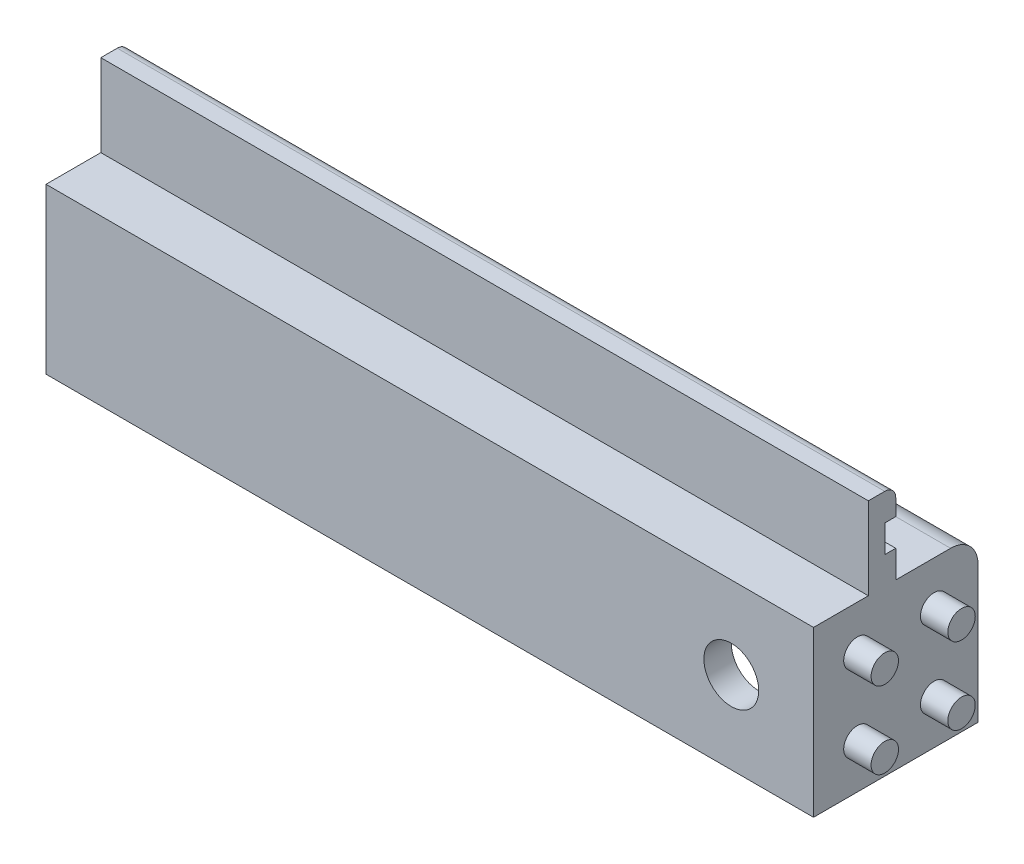
from build123d import *

# Parameters (mm, degrees)
SKETCH1_W                                       = 140
SKETCH1_H                                       = 30
BOSS_EXTRUDE1_DEPTH                             = 30
SHELL1_T                                        = -5
SKETCH3_W                                       = 5
SKETCH3_H                                       = 20
BOSS_EXTRUDE2_DEPTH                             = 25
SKETCH4_R                                       = 2.5
BOSS_EXTRUDE3_DEPTH                             = 5
SKETCH5_R                                       = 1.5
CUT_EXTRUDE1_DEPTH                              = 20
CUT_EXTRUDE2_DEPTH                              = 152.079449297
CUT_EXTRUDE2_DEPTH_BACK                         = 152.079449297
SKETCH9_R                                       = 5
SKETCH10_W                                      = 140
SKETCH10_H                                      = 5
BOSS_EXTRUDE5_DEPTH                             = 15
CUT_EXTRUDE3_START                              = -3
SKETCH14_W                                      = 135
SKETCH14_H                                      = 5
CUT_EXTRUDE3_DEPTH                              = 2
FILLET1_R                                       = 2
CSK_FOR_M5_FLAT_HEAD_MACHINE_SCREW1_D           = 5.5
CSK_FOR_M5_FLAT_HEAD_MACHINE_SCREW1_DEPTH       = 20
CSK_FOR_M5_FLAT_HEAD_MACHINE_SCREW1_CSINK_D     = 10.4
CSK_FOR_M5_FLAT_HEAD_MACHINE_SCREW1_CSINK_ANGLE = 90
CSK_FOR_M5_FLAT_HEAD_MACHINE_SCREW1_TIP         = 1.652366702
FILLET2_R                                       = 5


with BuildPart() as part:
    # Sketch1 → Boss-Extrude1 (new body)
    with BuildSketch(Plane(origin=(0, 0, 0), x_dir=(1, 0, 0), z_dir=(0, 1, 0))):
        with Locations((70, 15)):
            Rectangle(SKETCH1_W, SKETCH1_H)
    extrude(amount=BOSS_EXTRUDE1_DEPTH)

    # Shell1
    shell1_openings = [part.faces().sort_by_distance(p)[0] for p in [
        (70, 0, -15),
    ]]
    offset(amount=SHELL1_T, openings=shell1_openings, kind=Kind.INTERSECTION)

    # Sketch3 → Boss-Extrude2 (add)
    with BuildSketch(Plane.XZ.offset(-25)):
        with Locations((52.5, -15)):
            Rectangle(SKETCH3_W, SKETCH3_H)
    extrude(amount=BOSS_EXTRUDE2_DEPTH)

    # Sketch4 → Boss-Extrude3 (add)
    with BuildSketch(Plane(origin=(140, 0, 0), x_dir=(0, 0, -1), z_dir=(1, 0, 0))):
        with Locations(Location((8, 22, 0), (0, 0, 180))):
            Circle(SKETCH4_R)
        with Locations(Location((22, 22, 0), (0, 0, 180))):
            Circle(SKETCH4_R)
        with Locations(Location((8, 8, 0), (0, 0, 180))):
            Circle(SKETCH4_R)
        with Locations(Location((22, 8, 0), (0, 0, 180))):
            Circle(SKETCH4_R)
    extrude(amount=BOSS_EXTRUDE3_DEPTH)

    # Sketch5 → Cut-Extrude1 (cut)
    with BuildSketch(Plane.ZY):
        with Locations((-15, 15)):
            Circle(SKETCH5_R)
    extrude(amount=-CUT_EXTRUDE1_DEPTH, mode=Mode.SUBTRACT)

    # Sketch9 → Cut-Extrude2 (cut, two sides: drawn at the far end of the back side and taken through both)
    with BuildSketch(Plane(origin=(0, 0, -30), x_dir=(-1, 0, 0), z_dir=(0, 0, -1)).offset(-CUT_EXTRUDE2_DEPTH_BACK)):
        with Locations(Location((-125, 15, 0), (0, 0, 180))):
            Circle(SKETCH9_R)
    extrude(amount=CUT_EXTRUDE2_DEPTH + CUT_EXTRUDE2_DEPTH_BACK, mode=Mode.SUBTRACT)

    # Sketch10 → Boss-Extrude5 (add)
    with BuildSketch(Plane(origin=(0, 30, 0), x_dir=(1, 0, 0), z_dir=(0, 1, 0))):
        with Locations((70, 12.5)):
            Rectangle(SKETCH10_W, SKETCH10_H)
    extrude(amount=BOSS_EXTRUDE5_DEPTH)

    # Sketch14 → Cut-Extrude3 (cut)
    with BuildSketch(Plane.XY.offset(-10).offset(CUT_EXTRUDE3_START)):
        with Locations((72.5, 37.5)):
            Rectangle(SKETCH14_W, SKETCH14_H)
    extrude(amount=-CUT_EXTRUDE3_DEPTH, mode=Mode.SUBTRACT)

    # Fillet1
    fillet1_edges = [part.edges().sort_by_distance(p)[0] for p in [
        (70, 45, -15),
    ]]
    fillet(fillet1_edges, radius=FILLET1_R)

    # CSK for M5 Flat Head Machine Screw1
    with Locations(Plane.ZY):
        with Locations((-15, 15)):
            CounterSinkHole(CSK_FOR_M5_FLAT_HEAD_MACHINE_SCREW1_D / 2, CSK_FOR_M5_FLAT_HEAD_MACHINE_SCREW1_CSINK_D / 2, depth=CSK_FOR_M5_FLAT_HEAD_MACHINE_SCREW1_DEPTH, counter_sink_angle=CSK_FOR_M5_FLAT_HEAD_MACHINE_SCREW1_CSINK_ANGLE)
            with Locations((0, 0, -(CSK_FOR_M5_FLAT_HEAD_MACHINE_SCREW1_DEPTH + CSK_FOR_M5_FLAT_HEAD_MACHINE_SCREW1_TIP / 2))):  # 118° drill point
                Cone(0, CSK_FOR_M5_FLAT_HEAD_MACHINE_SCREW1_D / 2, CSK_FOR_M5_FLAT_HEAD_MACHINE_SCREW1_TIP, mode=Mode.SUBTRACT)

    # Fillet2
    fillet2_edges = [part.edges().sort_by_distance(p)[0] for p in [
        (70, 30, -30),
    ]]
    fillet(fillet2_edges, radius=FILLET2_R)


solid = part.part
